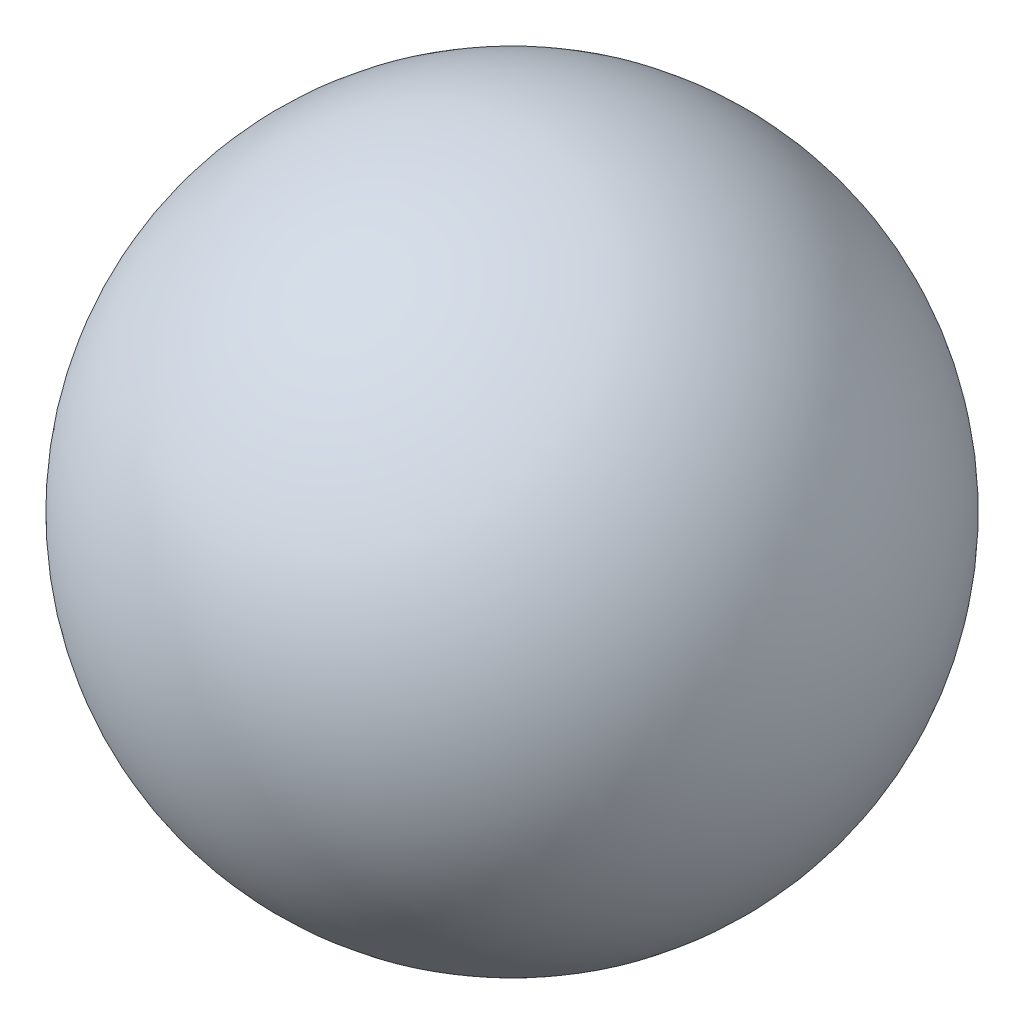
from build123d import *


with BuildPart() as part:
    # Sketch1 → Revolve1 (revolve)
    with BuildSketch(Plane.XY):
        with BuildLine():
            Line((0, 20), (0, 19))
            ThreePointArc((0, 19), (19, 0), (0, -19))
            Line((0, -19), (0, -20))
            ThreePointArc((0, -20), (20, 0), (0, 20))
        make_face()
    revolve(axis=Axis((0, 20, 0), (0, -1, 0)))


solid = part.part
